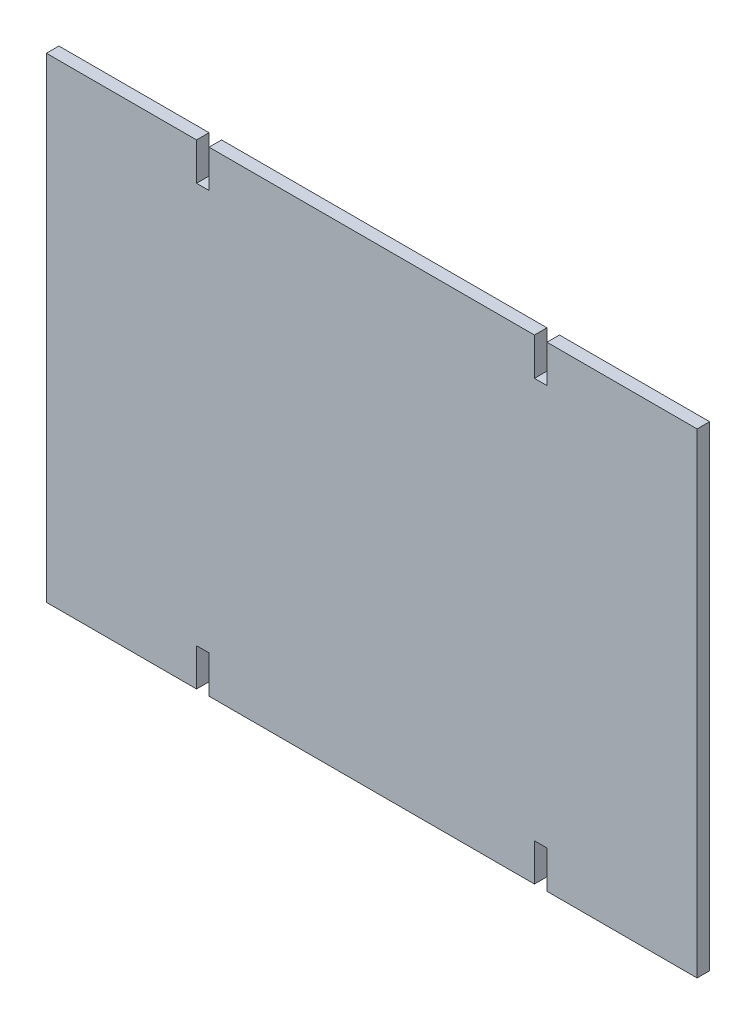
from build123d import *

# Parameters (mm, degrees)
SKETCH1_W           = 260
SKETCH1_H           = 190
BOSS_EXTRUDE1_DEPTH = 5
SKETCH2_W           = 5
SKETCH2_H           = 15
CUT_EXTRUDE1_DEPTH  = 5


with BuildPart() as part:
    # Sketch1 → Boss-Extrude1 (new body)
    with BuildSketch(Plane.XY):
        with Locations((130, -95)):
            Rectangle(SKETCH1_W, SKETCH1_H)
    extrude(amount=BOSS_EXTRUDE1_DEPTH)

    # Sketch2 → Cut-Extrude1 (cut)
    with BuildSketch(Plane(origin=(0, 0, 0), x_dir=(-1, 0, 0), z_dir=(0, 0, -1))):
        with Locations((-197.5, -7.5)):
            Rectangle(SKETCH2_W, SKETCH2_H)
        with Locations((-197.5, -182.5)):
            Rectangle(SKETCH2_W, SKETCH2_H)
        with Locations((-62.5, -7.5)):
            Rectangle(SKETCH2_W, SKETCH2_H)
        with Locations((-62.5, -182.5)):
            Rectangle(SKETCH2_W, SKETCH2_H)
    extrude(amount=-CUT_EXTRUDE1_DEPTH, mode=Mode.SUBTRACT)


solid = part.part
